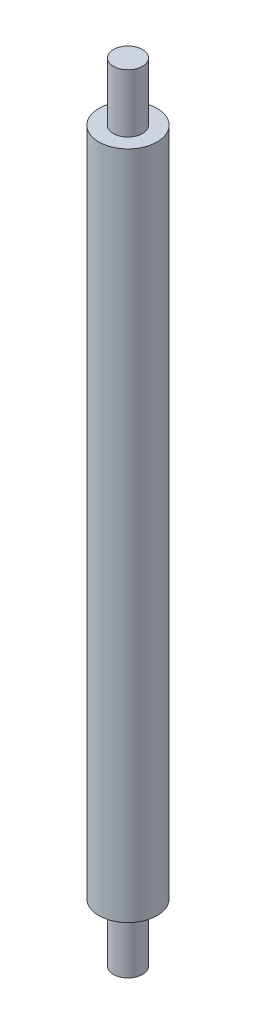
from build123d import *

# Parameters (mm, degrees)
SKETCH1_R           = 5
BOSS_EXTRUDE1_DEPTH = 115
SKETCH2_R           = 2.5
BOSS_EXTRUDE2_DEPTH = 10


with BuildPart() as part:
    # Sketch1 → Boss-Extrude1 (new body)
    with BuildSketch(Plane(origin=(0, 0, 0), x_dir=(1, 0, 0), z_dir=(0, 1, 0))):
        with Locations(Location((-0.95128767, -2.46214322, 0), (0, 0, 270))):
            Circle(SKETCH1_R)
    extrude(amount=BOSS_EXTRUDE1_DEPTH)

    # Sketch2 → Boss-Extrude2 (add)
    with BuildSketch(Plane.XZ):
        with Locations(Location((-0.95128767, 2.46214322, 0), (0, 0, 270))):
            Circle(SKETCH2_R)
    boss_extrude2 = extrude(amount=BOSS_EXTRUDE2_DEPTH)

    # Mirror1: Boss-Extrude2 across plane
    add(boss_extrude2.mirror(Plane.ZX.offset(57.5)))


solid = part.part
